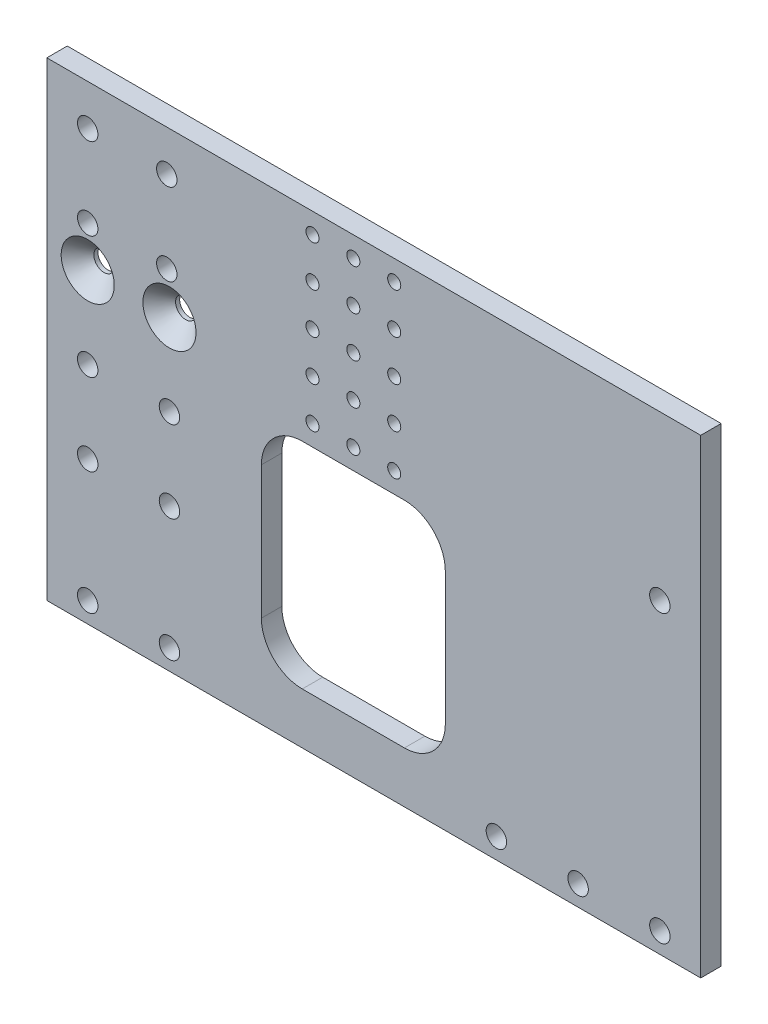
from build123d import *

# Parameters (mm, degrees)
SKETCH1_W               = 203.2
SKETCH1_H               = 146.05
BOSS_EXTRUDE1_DEPTH     = 6.35
CUT_EXTRUDE1_DEPTH      = 251.322122474
CUT_EXTRUDE1_DEPTH_BACK = 251.322122474
SKETCH2_R               = 3.175
CUT_EXTRUDE2_DEPTH      = 251.322122474
CUT_EXTRUDE2_DEPTH_BACK = 251.322122474
SKETCH3_R               = 2.032
CUT_EXTRUDE3_DEPTH      = 251.322122474
CUT_EXTRUDE3_DEPTH_BACK = 251.322122474
SKETCH4_W               = 57.15
SKETCH4_H               = 66.675
FILLET1_R               = 12.7
CHAMFER1_SIZE           = 5.08


with BuildPart() as part:
    # Sketch1 → Boss-Extrude1 (new body)
    with BuildSketch(Plane.XY):
        with Locations((101.6, 73.025)):
            Rectangle(SKETCH1_W, SKETCH1_H)
    extrude(amount=BOSS_EXTRUDE1_DEPTH)

    # Sketch2 → Cut-Extrude1 (cut, two sides: drawn at the far end of the back side and taken through both)
    with BuildSketch(Plane.XY.offset(6.35).offset(-CUT_EXTRUDE1_DEPTH_BACK)):
        with Locations((12.7, 133.35)):
            Circle(SKETCH2_R)
        with Locations((37.270330063, 133.35)):
            Circle(SKETCH2_R)
        with Locations((12.7, 107.904145464)):
            Circle(SKETCH2_R)
        with Locations((37.270330063, 107.904145464)):
            Circle(SKETCH2_R)
        with Locations((12.7, 95.25)):
            Circle(SKETCH2_R)
        with Locations((38.1, 95.25)):
            Circle(SKETCH2_R)
        with Locations((12.7, 69.85)):
            Circle(SKETCH2_R)
        with Locations((38.1, 69.85)):
            Circle(SKETCH2_R)
        with Locations((12.7, 44.45)):
            Circle(SKETCH2_R)
        with Locations((38.1, 44.45)):
            Circle(SKETCH2_R)
        with Locations((12.7, 6.35)):
            Circle(SKETCH2_R)
        with Locations((38.1, 6.35)):
            Circle(SKETCH2_R)
        with Locations((139.7, 6.35)):
            Circle(SKETCH2_R)
        with Locations((165.1, 6.35)):
            Circle(SKETCH2_R)
        with Locations((190.5, 6.35)):
            Circle(SKETCH2_R)
        with Locations((190.5, 95.25)):
            Circle(SKETCH2_R)
    extrude(amount=CUT_EXTRUDE1_DEPTH + CUT_EXTRUDE1_DEPTH_BACK, mode=Mode.SUBTRACT)

    # Sketch3 → Cut-Extrude2 (cut, two sides: drawn at the far end of the back side and taken through both)
    with BuildSketch(Plane.XY.offset(6.35).offset(-CUT_EXTRUDE2_DEPTH_BACK)):
        with Locations((95.25, 139.7)):
            Circle(SKETCH3_R)
        with Locations((107.95, 139.7)):
            Circle(SKETCH3_R)
        with Locations((82.55, 139.7)):
            Circle(SKETCH3_R)
        with Locations((107.95, 127)):
            Circle(SKETCH3_R)
        with Locations((95.25, 127)):
            Circle(SKETCH3_R)
        with Locations((82.55, 127)):
            Circle(SKETCH3_R)
        with Locations((107.95, 114.3)):
            Circle(SKETCH3_R)
        with Locations((95.25, 114.3)):
            Circle(SKETCH3_R)
        with Locations((82.55, 114.3)):
            Circle(SKETCH3_R)
        with Locations((107.95, 101.6)):
            Circle(SKETCH3_R)
        with Locations((95.25, 101.6)):
            Circle(SKETCH3_R)
        with Locations((82.55, 101.6)):
            Circle(SKETCH3_R)
        with Locations((107.95, 88.9)):
            Circle(SKETCH3_R)
        with Locations((95.25, 88.9)):
            Circle(SKETCH3_R)
        with Locations((82.55, 88.9)):
            Circle(SKETCH3_R)
    extrude(amount=CUT_EXTRUDE2_DEPTH + CUT_EXTRUDE2_DEPTH_BACK, mode=Mode.SUBTRACT)

    # Sketch4 → Cut-Extrude3 (cut, two sides: drawn at the far end of the back side and taken through both)
    with BuildSketch(Plane.XY.offset(6.35).offset(-CUT_EXTRUDE3_DEPTH_BACK)):
        with Locations((95.25, 49.2125)):
            Rectangle(SKETCH4_W, SKETCH4_H)
    extrude(amount=CUT_EXTRUDE3_DEPTH + CUT_EXTRUDE3_DEPTH_BACK, mode=Mode.SUBTRACT)

    # Fillet1
    fillet1_edges = [part.edges().sort_by_distance(p)[0] for p in [
        (66.675, 15.875, 3.175),
        (66.675, 82.55, 3.175),
        (123.825, 82.55, 3.175),
        (123.825, 15.875, 3.175),
    ]]
    fillet(fillet1_edges, radius=FILLET1_R)

    # Chamfer1
    chamfer1_edges = [part.edges().sort_by_distance(p)[0] for p in [
        (34.925, 95.25, 6.35),
        (9.525, 95.25, 6.35),
    ]]
    chamfer(chamfer1_edges, length=CHAMFER1_SIZE)


solid = part.part
